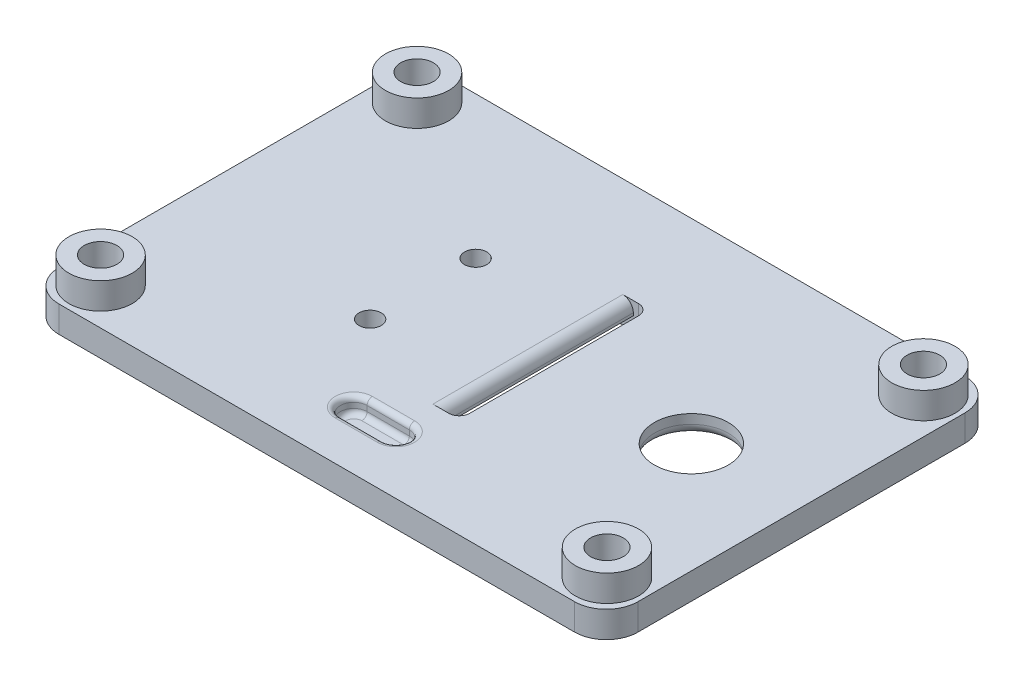
from build123d import *

# Parameters (mm, degrees)
SKETCH_1_R           = 1.55
EXTRUDE_1_DEPTH      = 2.5
SKETCH_2_R           = 3
EXTRUDE_2_DEPTH      = 2.5
SKETCH_3_R           = 1.55
CUT_EXTRUDE_1_DEPTH  = 34.466573357
SKETCH_5_R           = 3.5
CUT_EXTRUDE_3_DEPTH  = 34.466573357
CUT_EXTRUDE_6_DEPTH  = 1.5
FILLET_4_R           = 0.5
CHAMFER_1_SIZE       = 2
CHAMFER_1_SIZE2      = 1
FILLET_5_R           = 1
CUT_EXTRUDE_7_DEPTH  = 34.466573357
SKETCH_20_W          = 5
SKETCH_20_H          = 18
CUT_EXTRUDE_10_DEPTH = 34.486179612
FILLET_9_R           = 1
SKETCH_23_R          = 1.05
CUT_EXTRUDE_11_DEPTH = 34.466573357
FILLET_10_R          = 1


with BuildPart() as part:
    # 草图1 → 凸台-拉伸1 (new body)
    with BuildSketch(Plane(origin=(0, 0, 0), x_dir=(1, 0, 0), z_dir=(0, 1, 0))):
        with BuildLine():
            Line((-27.4365, 0), (-27.4365, 15.5))
            ThreePointArc((-27.4365, 15.5), (-26.557820344, 17.621320344), (-24.4365, 18.5))
            Line((-24.4365, 18.5), (0, 18.5))
            Line((0, 18.5), (24.4365, 18.5))
            ThreePointArc((24.4365, 18.5), (26.557820344, 17.621320344), (27.4365, 15.5))
            Line((27.4365, 15.5), (27.4365, 0))
            Line((27.4365, 0), (27.4365, -15.5))
            ThreePointArc((27.4365, -15.5), (26.557820344, -17.621320344), (24.4365, -18.5))
            Line((24.4365, -18.5), (0, -18.5))
            Line((0, -18.5), (-24.4365, -18.5))
            ThreePointArc((-24.4365, -18.5), (-26.557820344, -17.621320344), (-27.4365, -15.5))
            Line((-27.4365, -15.5), (-27.4365, 0))
        make_face()
        with Locations((-24, 15)):
            Circle(SKETCH_1_R, mode=Mode.SUBTRACT)
        with Locations((24, 15)):
            Circle(SKETCH_1_R, mode=Mode.SUBTRACT)
        with Locations((24, -15)):
            Circle(SKETCH_1_R, mode=Mode.SUBTRACT)
        with Locations((-24, -15)):
            Circle(SKETCH_1_R, mode=Mode.SUBTRACT)
    extrude(amount=EXTRUDE_1_DEPTH)

    # 草图2 → 凸台-拉伸2 (add)
    with BuildSketch(Plane(origin=(0, 2.5, 0), x_dir=(1, 0, 0), z_dir=(0, 1, 0))):
        with Locations((-24, 15)):
            Circle(SKETCH_2_R)
        with Locations((24, 15)):
            Circle(SKETCH_2_R)
        with Locations((-24, -15)):
            Circle(SKETCH_2_R)
        with Locations((24, -15)):
            Circle(SKETCH_2_R)
    extrude(amount=EXTRUDE_2_DEPTH)

    # 草图3 → 切除-拉伸1 (cut, through all)
    with BuildSketch(Plane.XZ):
        with Locations((-24, 15)):
            Circle(SKETCH_3_R)
        with Locations((24, 15)):
            Circle(SKETCH_3_R)
        with Locations((-24, -15)):
            Circle(SKETCH_3_R)
        with Locations((24, -15)):
            Circle(SKETCH_3_R)
    extrude(amount=-CUT_EXTRUDE_1_DEPTH, mode=Mode.SUBTRACT)

    # 草图5 → 切除-拉伸3 (cut, through all)
    with BuildSketch(Plane.XZ):
        with Locations((17, 0)):
            Circle(SKETCH_5_R)
    extrude(amount=-CUT_EXTRUDE_3_DEPTH, mode=Mode.SUBTRACT)

    # 草图9 → 切除-拉伸6 (cut)
    with BuildSketch(Plane(origin=(0, 2.5, 0), x_dir=(1, 0, 0), z_dir=(0, 1, 0))):
        with BuildLine():
            Line((-2, -11.732050808), (2, -11.732050808))
            ThreePointArc((2, -11.732050808), (3.267949192, -13), (2, -14.267949192))
            Line((2, -14.267949192), (-2, -14.267949192))
            ThreePointArc((-2, -14.267949192), (-3.267949192, -13), (-2, -11.732050808))
        make_face()
    extrude(amount=-CUT_EXTRUDE_6_DEPTH, mode=Mode.SUBTRACT)

    # 圆角4
    fillet_4_edges = [part.edges().sort_by_distance(p)[0] for p in [
        (0, 1, 14.267949192),
        (-3.267949192, 1, 13),
        (0, 1, 11.732050808),
        (3.267949192, 1, 13),
        (3.267949192, 2.5, 13),
        (0, 2.5, 14.267949192),
        (-3.267949192, 2.5, 13),
        (0, 2.5, 11.732050808),
    ]]
    fillet(fillet_4_edges, radius=FILLET_4_R)

    # 倒角1
    chamfer_1_edges = [part.edges().sort_by_distance(p)[0] for p in [
        (13.5, 0, 0),
    ]]
    chamfer_1_side = [part.faces().sort_by_distance(p)[0] for p in [
        (-0.334836292, 0, 0),
    ]]
    chamfer(chamfer_1_edges, length=CHAMFER_1_SIZE, length2=CHAMFER_1_SIZE2, reference=chamfer_1_side[0])

    # 圆角5
    fillet_5_edges = [part.edges().sort_by_distance(p)[0] for p in [
        (13.5, 1, 0),
        (11.5, 0, 0),
    ]]
    fillet(fillet_5_edges, radius=FILLET_5_R)

    # 草图10 → 切除-拉伸7 (cut, through all)
    with BuildSketch(Plane.XZ):
        Polygon((2.5, 0), (2.5, 9), (4, 9), (4, -9), (2.5, -9), align=None)
    extrude(amount=-CUT_EXTRUDE_7_DEPTH, mode=Mode.SUBTRACT)

    # 草图20 → 切除-拉伸10 (cut, through all)
    with BuildSketch(Plane(origin=(-0.03944063, 0.086049296, 0), x_dir=(0.9090593428863095, 0.41666666666666674, 0), z_dir=(-0.4166666666666668, 0.9090593428863096, 0))):
        with Locations((0.293481691, 0)):
            Rectangle(SKETCH_20_W, SKETCH_20_H)
    extrude(amount=-CUT_EXTRUDE_10_DEPTH, mode=Mode.SUBTRACT)

    # 圆角9
    fillet_9_edges = [part.edges().sort_by_distance(p)[0] for p in [
        (-0.227178029, 0, 0),
        (2.5, 2.5, 0),
    ]]
    fillet(fillet_9_edges, radius=FILLET_9_R)

    # 草图23 → 切除-拉伸11 (cut, through all)
    with BuildSketch(Plane.XZ):
        with Locations((-8.445435606, 5)):
            Circle(SKETCH_23_R)
        with Locations((-8.445435606, -5)):
            Circle(SKETCH_23_R)
    extrude(amount=-CUT_EXTRUDE_11_DEPTH, mode=Mode.SUBTRACT)

    # 圆角10
    fillet_10_edges = [part.edges().sort_by_distance(p)[0] for p in [
        (4, 1.25, -9),
        (4, 1.25, 9),
    ]]
    fillet(fillet_10_edges, radius=FILLET_10_R)


solid = part.part
